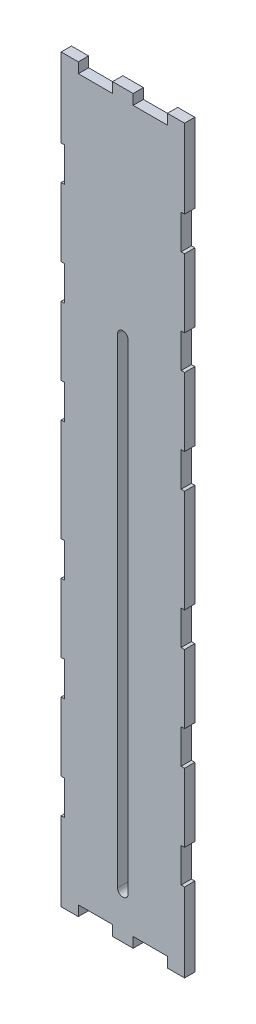
from build123d import *

# Parameters (mm, degrees)
SKETCH1_W           = 34
SKETCH1_H           = 210
SKETCH1_W_2         = 1
SKETCH1_H_2         = 20
SKETCH1_H_3         = 30
SKETCH1_W_3         = 6
SKETCH1_H_4         = 3
BOSS_EXTRUDE1_DEPTH = 3
CUT_EXTRUDE1_DEPTH  = 216.877279953


with BuildPart() as part:
    # Sketch1 → Boss-Extrude1 (new body)
    with BuildSketch(Plane.XY):
        with Locations((17, 105)):
            Rectangle(SKETCH1_W, SKETCH1_H)
        with Locations((34.5, 200)):
            Rectangle(SKETCH1_W_2, SKETCH1_H_2)
        with Locations((-0.5, 200)):
            Rectangle(SKETCH1_W_2, SKETCH1_H_2)
        with Locations((-0.5, 170)):
            Rectangle(SKETCH1_W_2, SKETCH1_H_2)
        with Locations((34.5, 170)):
            Rectangle(SKETCH1_W_2, SKETCH1_H_2)
        with Locations((34.5, 140)):
            Rectangle(SKETCH1_W_2, SKETCH1_H_2)
        with Locations((-0.5, 140)):
            Rectangle(SKETCH1_W_2, SKETCH1_H_2)
        with Locations((-0.5, 105)):
            Rectangle(SKETCH1_W_2, SKETCH1_H_3)
        with Locations((34.5, 105)):
            Rectangle(SKETCH1_W_2, SKETCH1_H_3)
        with Locations((34.5, 70)):
            Rectangle(SKETCH1_W_2, SKETCH1_H_2)
        with Locations((-0.5, 70)):
            Rectangle(SKETCH1_W_2, SKETCH1_H_2)
        with Locations((-0.5, 40)):
            Rectangle(SKETCH1_W_2, SKETCH1_H_2)
        with Locations((34.5, 40)):
            Rectangle(SKETCH1_W_2, SKETCH1_H_2)
        with Locations((34.5, 10)):
            Rectangle(SKETCH1_W_2, SKETCH1_H_2)
        with Locations((-0.5, 10)):
            Rectangle(SKETCH1_W_2, SKETCH1_H_2)
        Polygon((4, 0), (0, 0), (-1, 0), (-1, -3), (4, -3), align=None)
        with Locations((17, -1.5)):
            Rectangle(SKETCH1_W_3, SKETCH1_H_4)
        Polygon((34, 0), (30, 0), (30, -3), (35, -3), (35, 0), align=None)
        Polygon((-1, 210), (0, 210), (4, 210), (4, 213), (-1, 213), align=None)
        with Locations((17, 211.5)):
            Rectangle(SKETCH1_W_3, SKETCH1_H_4)
        Polygon((30, 213), (30, 210), (34, 210), (35, 210), (35, 213), align=None)
    extrude(amount=BOSS_EXTRUDE1_DEPTH)

    # Sketch2 → Cut-Extrude1 (cut, through all)
    with BuildSketch(Plane.XY.offset(3)):
        with BuildLine():
            Line((18.55, 150), (18.55, 10))
            ThreePointArc((18.55, 10), (17, 8.45), (15.45, 10))
            Line((15.45, 10), (15.45, 150))
            ThreePointArc((15.45, 150), (17, 151.55), (18.55, 150))
        make_face()
    extrude(amount=-CUT_EXTRUDE1_DEPTH, mode=Mode.SUBTRACT)


solid = part.part
